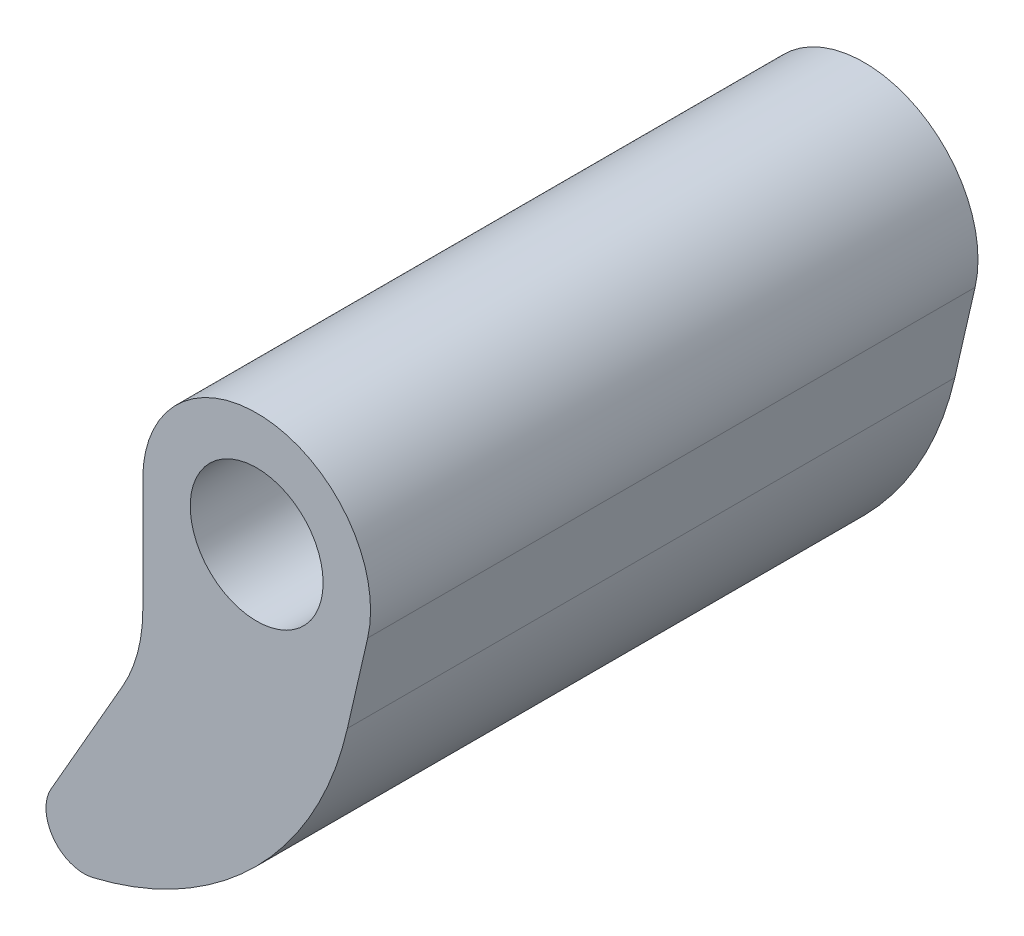
from build123d import *

# Parameters (mm, degrees)
SKETCH1_R           = 0.875
BOSS_EXTRUDE1_DEPTH = 8


with BuildPart() as part:
    # Sketch1 → Boss-Extrude1 (new body)
    with BuildSketch(Plane.XY):
        with BuildLine():
            Line((1.461962708, -0.335656133), (1.194637722, -1.5))
            ThreePointArc((1.194637722, -1.5), (-0.000233431, -3.667871775), (-2.159460582, -4.878294517))
            ThreePointArc((-2.159460582, -4.878294517), (-2.675445647, -4.690989074), (-2.708589557, -4.143060797))
            Line((-2.708589557, -4.143060797), (-1.766378918, -2.5))
            ThreePointArc((-1.766378918, -2.5), (-1.56773594, -2.017435437), (-1.5, -1.5))
            Line((-1.5, -1.5), (-1.5, 0))
            ThreePointArc((-1.5, 0), (0.168902246, 1.490460342), (1.461962708, -0.335656133))
        make_face()
        Circle(SKETCH1_R, mode=Mode.SUBTRACT)
    extrude(amount=BOSS_EXTRUDE1_DEPTH)


solid = part.part
